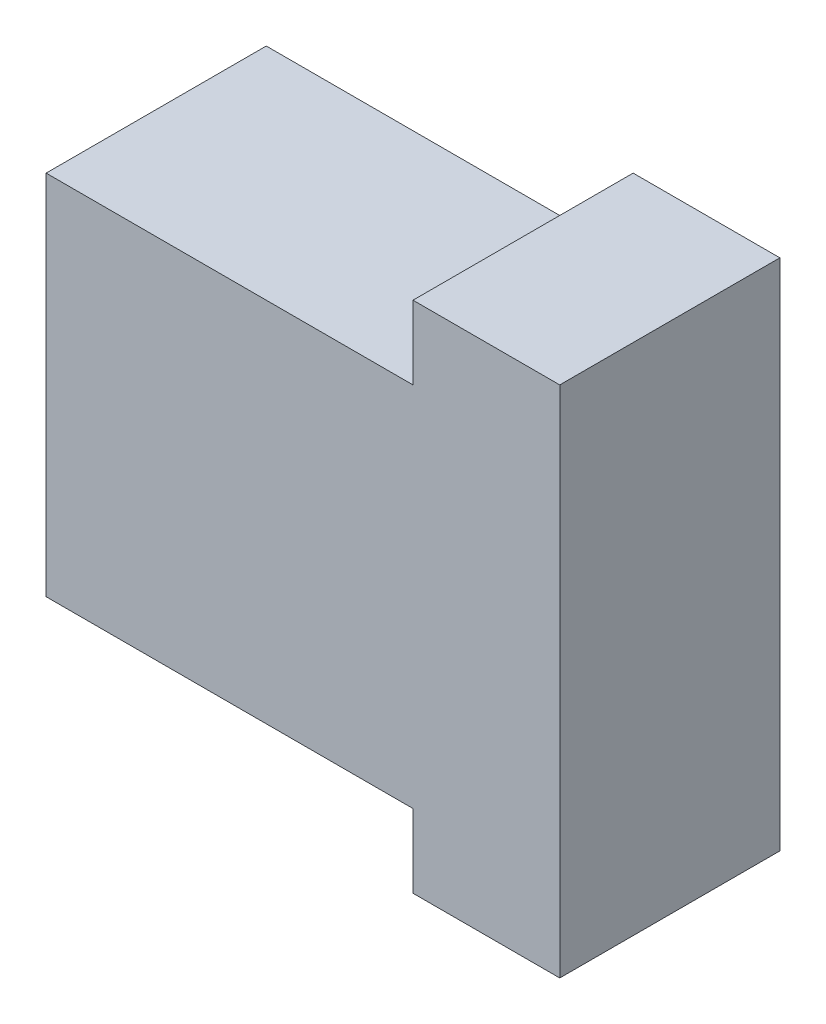
from build123d import *

# Parameters (mm, degrees)
CROQUIS1_W              = 5
CROQUIS1_H              = 5
SALIENTE_EXTRUIR1_DEPTH = 3


with BuildPart() as part:
    # Croquis1 → Saliente-Extruir1 (new body)
    with BuildSketch(Plane.XY):
        with Locations((-10.453849245, 5.502257497)):
            Rectangle(CROQUIS1_W, CROQUIS1_H)
        Polygon((-7.953849245, 9.002257497), (-7.953849245, 8.002257497), (-7.953849245, 3.002257497), (-7.953849245, 2.002257497), (-5.953849245, 2.002257497), (-5.953849245, 9.002257497), align=None)
    extrude(amount=SALIENTE_EXTRUIR1_DEPTH)


solid = part.part
